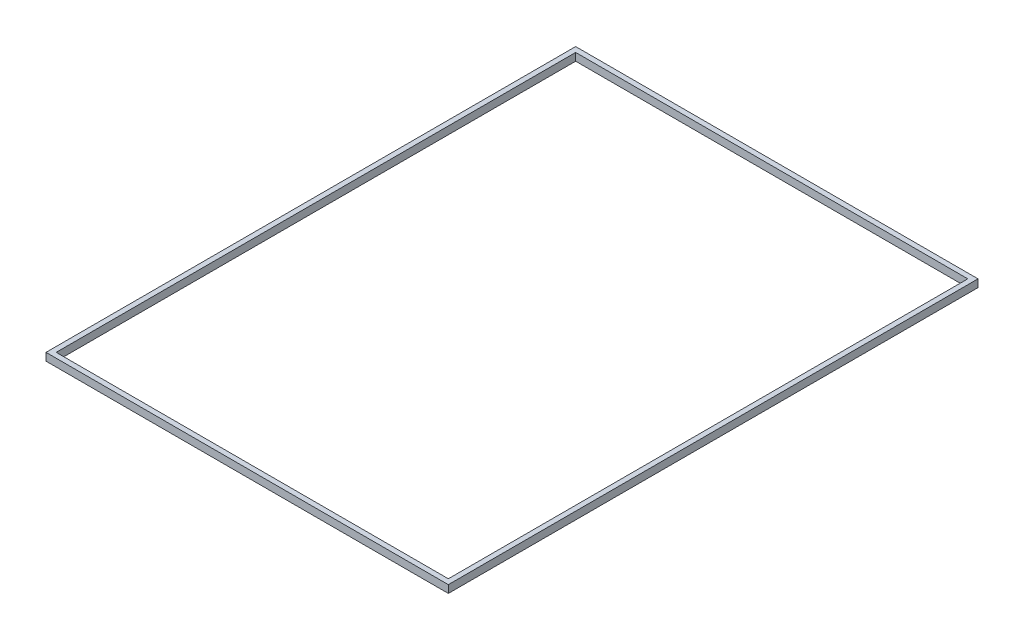
from build123d import *

# Parameters (mm, degrees)
SKETCH1_W           = 15800
SKETCH1_H           = 20800
SKETCH1_W_2         = 15400
SKETCH1_H_2         = 20400
BOSS_EXTRUDE1_DEPTH = 300


with BuildPart() as part:
    # Sketch1 → Boss-Extrude1 (new body)
    with BuildSketch(Plane(origin=(0, 0, 0), x_dir=(1, 0, 0), z_dir=(0, 1, 0))):
        with Locations((7700, -10200)):
            Rectangle(SKETCH1_W, SKETCH1_H)
        with Locations((7700, -10200)):
            Rectangle(SKETCH1_W_2, SKETCH1_H_2, mode=Mode.SUBTRACT)
    extrude(amount=BOSS_EXTRUDE1_DEPTH)


solid = part.part
